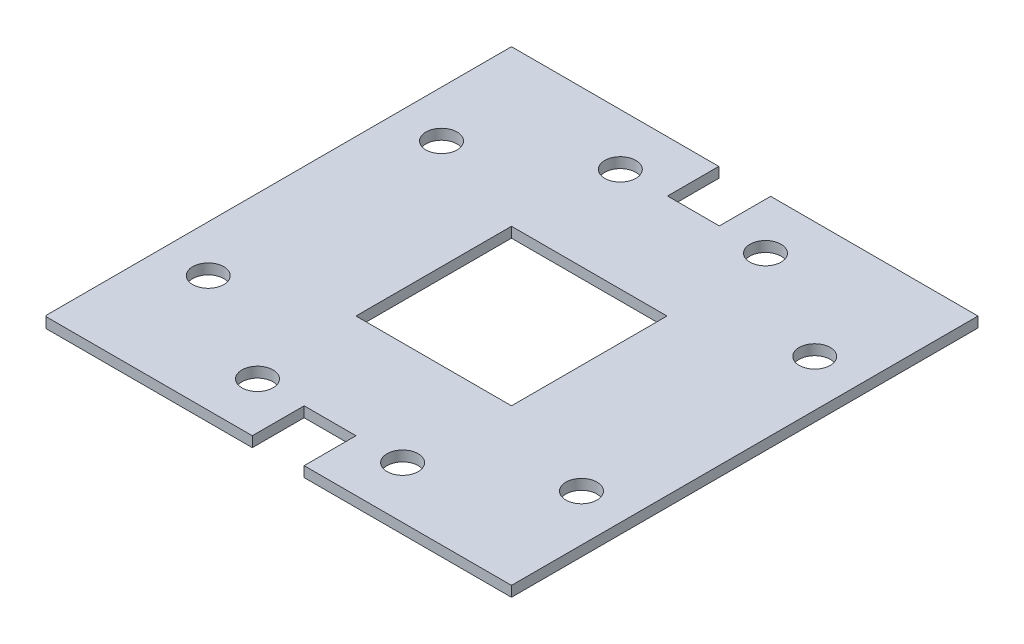
from build123d import *

# Parameters (mm, degrees)
CROQUIS1_R              = 1.5
CROQUIS1_W              = 15
CROQUIS1_H              = 15
SALIENTE_EXTRUIR1_DEPTH = 1
CROQUIS3_W              = 5
CROQUIS3_H              = 4.949226591
CROQUIS3_H_2            = 5
CORTAR_EXTRUIR2_DEPTH   = 10


with BuildPart() as part:
    # Croquis1 → Saliente-Extruir1 (new body)
    with BuildSketch(Plane(origin=(0, 0, 0), x_dir=(1, 0, 0), z_dir=(0, 1, 0))):
        with BuildLine():
            ThreePointArc((-15, -14.898453182), (-14.949747468, -14.949747468), (-14.898453182, -15))
            Line((-14.898453182, -15), (30, -15))
            Line((30, -15), (30, 30))
            Line((30, 30), (-15, 30))
            Line((-15, 30), (-15, -14.898453182))
        make_face()
        with Locations(Location((0.5, -10, 0), (0, 0, 270))):
            Circle(CROQUIS1_R, mode=Mode.SUBTRACT)
        with Locations(Location((-10.5, -3.75, 0), (0, 0, 270))):
            Circle(CROQUIS1_R, mode=Mode.SUBTRACT)
        with Locations(Location((14.5, -10, 0), (0, 0, 270))):
            Circle(CROQUIS1_R, mode=Mode.SUBTRACT)
        with Locations(Location((25.5, -3.75, 0), (0, 0, 270))):
            Circle(CROQUIS1_R, mode=Mode.SUBTRACT)
        with Locations(Location((-10.5, 18.75, 0), (0, 0, 270))):
            Circle(CROQUIS1_R, mode=Mode.SUBTRACT)
        with Locations(Location((0.5, 25, 0), (0, 0, 270))):
            Circle(CROQUIS1_R, mode=Mode.SUBTRACT)
        with Locations((7.5, 7.5)):
            Rectangle(CROQUIS1_W, CROQUIS1_H, mode=Mode.SUBTRACT)
        with Locations(Location((14.5, 25, 0), (0, 0, 270))):
            Circle(CROQUIS1_R, mode=Mode.SUBTRACT)
        with Locations(Location((25.5, 18.75, 0), (0, 0, 270))):
            Circle(CROQUIS1_R, mode=Mode.SUBTRACT)
    extrude(amount=SALIENTE_EXTRUIR1_DEPTH)

    # Croquis3 → Cortar-Extruir2 (cut)
    with BuildSketch(Plane(origin=(0, 1, 0), x_dir=(1, 0, 0), z_dir=(0, 1, 0))):
        with Locations((7.5, 27.525386705)):
            Rectangle(CROQUIS3_W, CROQUIS3_H)
        with Locations((7.5, -12.5)):
            Rectangle(CROQUIS3_W, CROQUIS3_H_2)
    extrude(amount=-CORTAR_EXTRUIR2_DEPTH, mode=Mode.SUBTRACT)


solid = part.part
